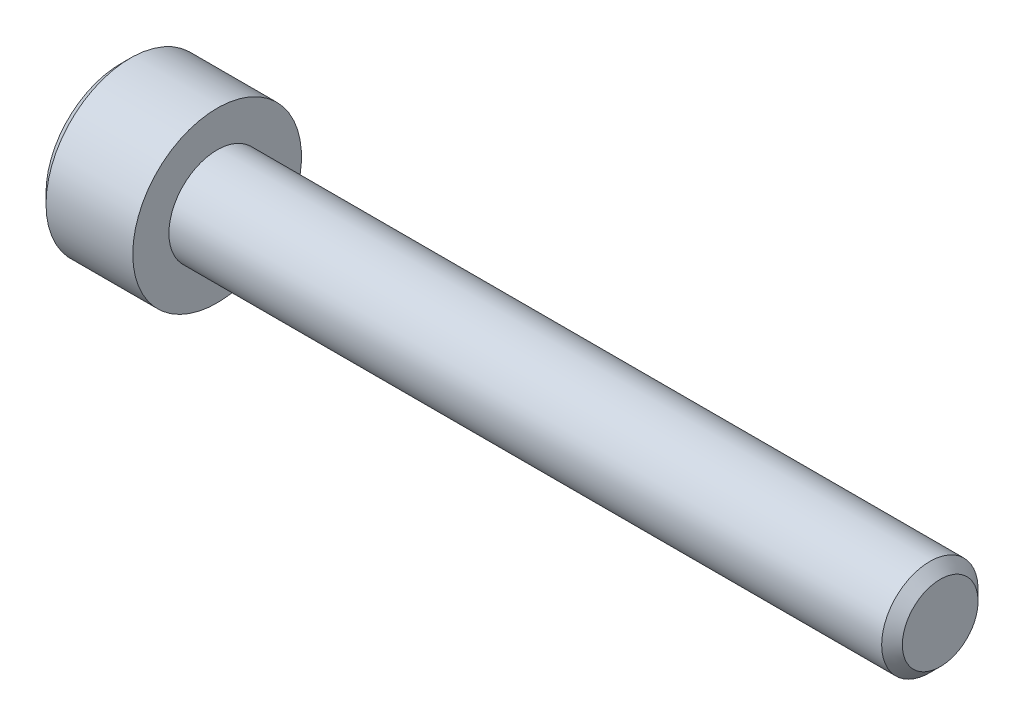
from build123d import *

# Parameters (mm, degrees)
CUT_EXTRUDE1_DEPTH = 2


with BuildPart() as part:
    # Sketch1 → Revolve1 (revolve)
    with BuildSketch(Plane.XY):
        Polygon((-4, 0), (30, 0), (30, -1.5705), (29.5705, -2), (0, -2), (0, -3.5), (-3.6, -3.5), (-4, -3.1), align=None)
    revolve(axis=Axis((-5.7, 0, 0), (1, 0, 0)))

    # Sketch2 → Cut-Extrude1 (cut)
    with BuildSketch(Plane.ZY.offset(4)):
        Polygon((0, 1.732050808), (-1.5, 0.866025404), (-1.5, -0.866025404), (0, -1.732050808), (1.5, -0.866025404), (1.5, 0.866025404), align=None)
    extrude(amount=-CUT_EXTRUDE1_DEPTH, mode=Mode.SUBTRACT)


solid = part.part
